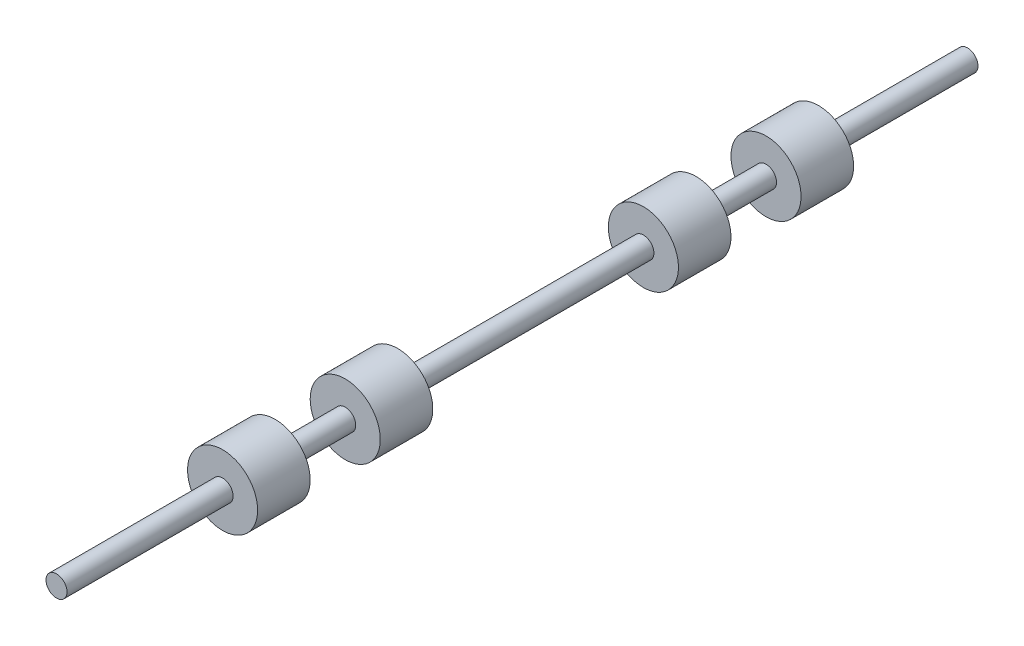
from build123d import *

# Parameters (mm, degrees)
SKETCH2_R           = 0.3
BOSS_EXTRUDE1_DEPTH = 26
SKETCH3_W           = 1
SKETCH3_H           = 1.5


with BuildPart() as part:
    # Sketch2 → Boss-Extrude1 (new body)
    with BuildSketch(Plane.XY):
        Circle(SKETCH2_R)
    extrude(amount=BOSS_EXTRUDE1_DEPTH)

    # Sketch3 → Revolve1 (revolve)
    with BuildSketch(Plane(origin=(0, 0, 0), x_dir=(1, 0, 0), z_dir=(0, 1, 0)), mode=Mode.PRIVATE) as revolve1_sk:
        with Locations((0.5, -5)):
            Rectangle(SKETCH3_W, SKETCH3_H)
        with Locations((0.5, -8.5)):
            Rectangle(SKETCH3_W, SKETCH3_H)
        with Locations((0.5, -17.01)):
            Rectangle(SKETCH3_W, SKETCH3_H)
        with Locations((0.5, -20.51)):
            Rectangle(SKETCH3_W, SKETCH3_H)
    revolve(revolve1_sk.sketch.rotate(Axis((0, 0, -1.249550455), (0, 0, 1)), 180), axis=Axis((0, 0, -1.249550455), (0, 0, 1)))


solid = part.part
